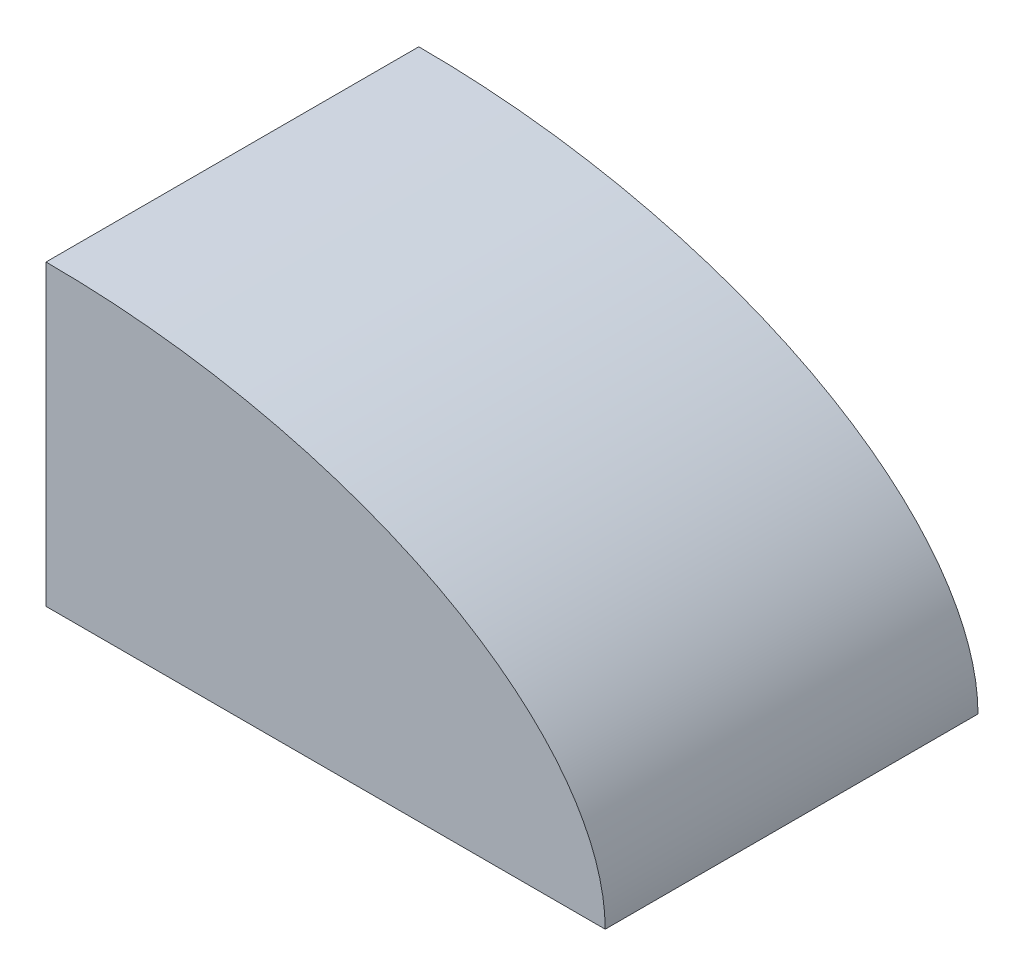
from build123d import *

# Parameters (mm, degrees)
BOSS_EXTRUDE1_DEPTH = 10


with BuildPart() as part:
    # Sketch1 → Boss-Extrude1 (new body)
    with BuildSketch(Plane.XY):
        with BuildLine():
            Line((10, 18), (10, 10))
            Line((10, 10), (25, 10))
            add(Edge.make_bspline(
                [(25, 10), (25, 18), (10, 18)],
                knots=[0, 0, 0, 1.570796327, 1.570796327, 1.570796327], degree=2, weights=[1, 0.707106781, 1]))
        make_face()
    extrude(amount=BOSS_EXTRUDE1_DEPTH)


solid = part.part
